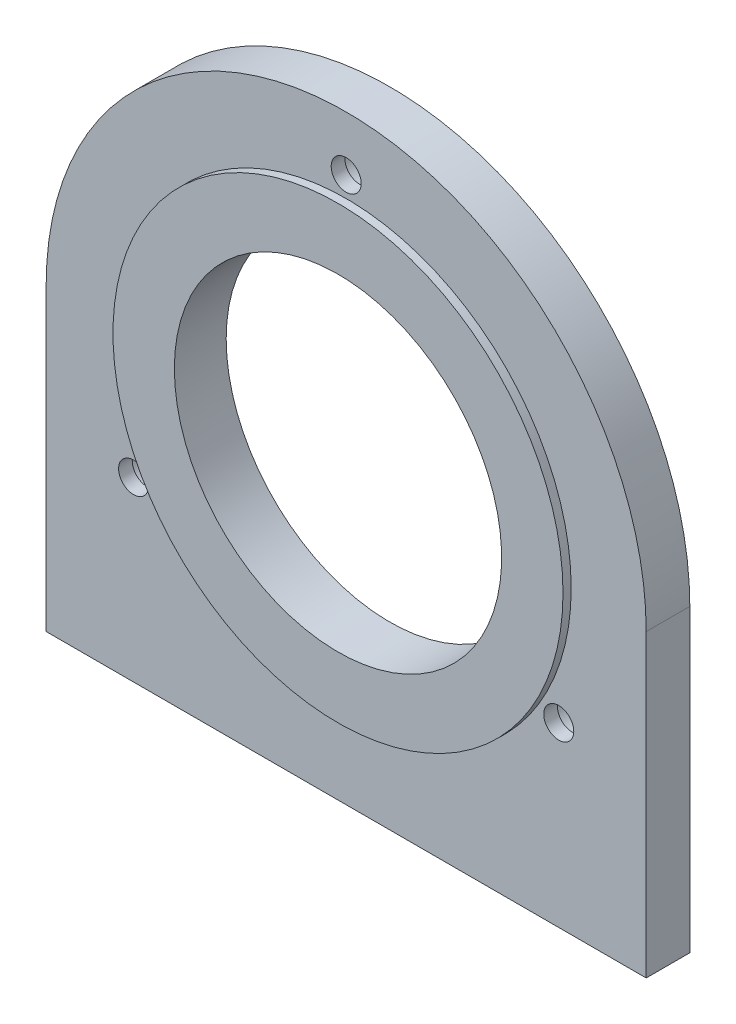
from build123d import *

# Parameters (mm, degrees)
SKETCH_1_R                = 110
EXTRUDE_1_DEPTH           = 16
SKETCH_2_W                = 220
SKETCH_2_H                = 110
EXTRUDE_2_DEPTH           = 16
SKETCH_3_R                = 82.5
EXTRUDE_3_DEPTH           = 3
HOLE_WIZARD_1_D           = 11
HOLE_WIZARD_1_CBORE_D     = 18
HOLE_WIZARD_1_CBORE_DEPTH = 11
PATTERN_CIRCULAR_1_COUNT  = 3
SKETCH_6_R                = 60
CUT_EXTRUDE_1_DEPTH       = 157.719494639


with BuildPart() as part:
    # 草图1 → 凸台-拉伸1 (new body)
    with BuildSketch(Plane.XY):
        Circle(SKETCH_1_R)
    extrude(amount=EXTRUDE_1_DEPTH)

    # 草图2 → 凸台-拉伸2 (add)
    with BuildSketch(Plane.XY.offset(16)):
        with Locations((0, -55)):
            Rectangle(SKETCH_2_W, SKETCH_2_H)
    extrude(amount=-EXTRUDE_2_DEPTH)

    # 草图3 → 凸台-拉伸3 (add)
    with BuildSketch(Plane.XY.offset(16)):
        Circle(SKETCH_3_R)
    extrude(amount=EXTRUDE_3_DEPTH)

    # 打孔尺寸(%根据)内六角圆柱头螺钉的类型1 (through all)
    with Locations(Plane(origin=(0, 0, 0), x_dir=(-1, 0, 0), z_dir=(0, 0, -1))):
        with Locations((0, 90)):
            hole_wizard_1 = CounterBoreHole(HOLE_WIZARD_1_D / 2, HOLE_WIZARD_1_CBORE_D / 2, HOLE_WIZARD_1_CBORE_DEPTH)

    # 阵列(圆周)1: 打孔尺寸(%根据)内六角圆柱头螺钉的类型1 ×3 about axis
    pattern_circular_1_axis = Axis((0, 0, 0), (0, 0, 1))
    for i in range(1, PATTERN_CIRCULAR_1_COUNT):
        add(hole_wizard_1.rotate(pattern_circular_1_axis, i * 360 / PATTERN_CIRCULAR_1_COUNT), mode=Mode.SUBTRACT)

    # 草图6 → 切除-拉伸1 (cut, through all)
    with BuildSketch(Plane(origin=(0, 0, 0), x_dir=(-1, 0, 0), z_dir=(0, 0, -1))):
        Circle(SKETCH_6_R)
    extrude(amount=-CUT_EXTRUDE_1_DEPTH, mode=Mode.SUBTRACT)


solid = part.part
